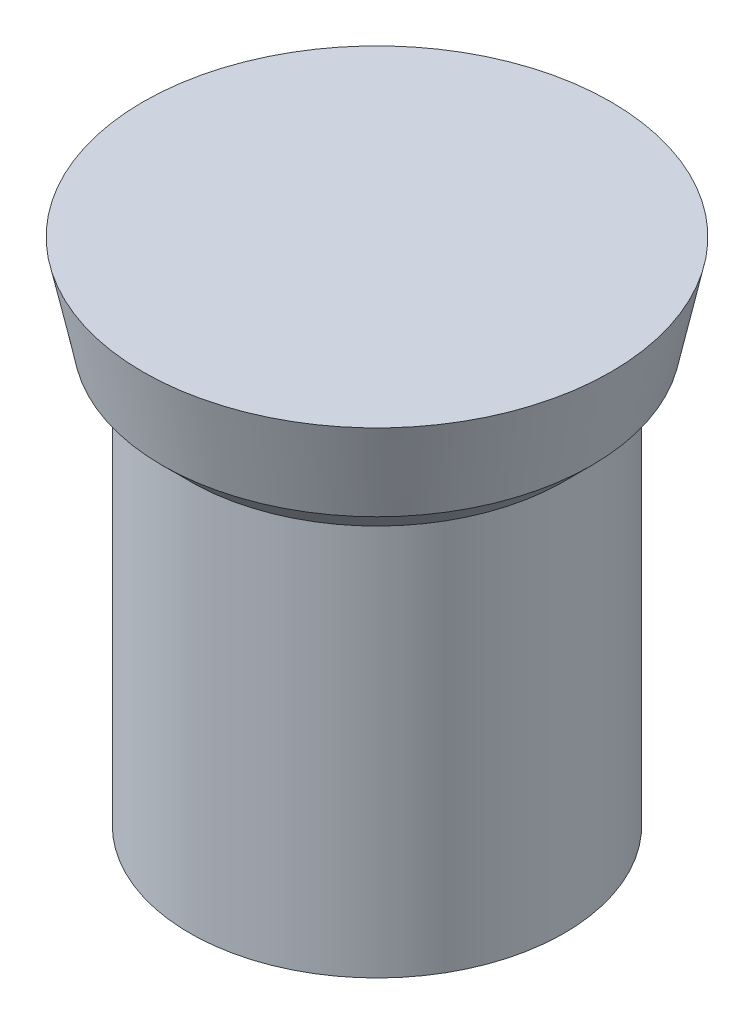
from build123d import *


with BuildPart() as part:
    # Sketch1 → Revolve1 (revolve)
    with BuildSketch(Plane.XY, mode=Mode.PRIVATE) as revolve1_sk:
        Polygon((0, 0), (0, 13.5), (6.2, 13.5), (5.689864252, 11.1), (4.9609375, 10.371073248), (4.9609375, 0), align=None)
    revolve(revolve1_sk.sketch.rotate(Axis((0, 0, 0), (0, 1, 0)), 90), axis=Axis((0, 0, 0), (0, 1, 0)))


solid = part.part
